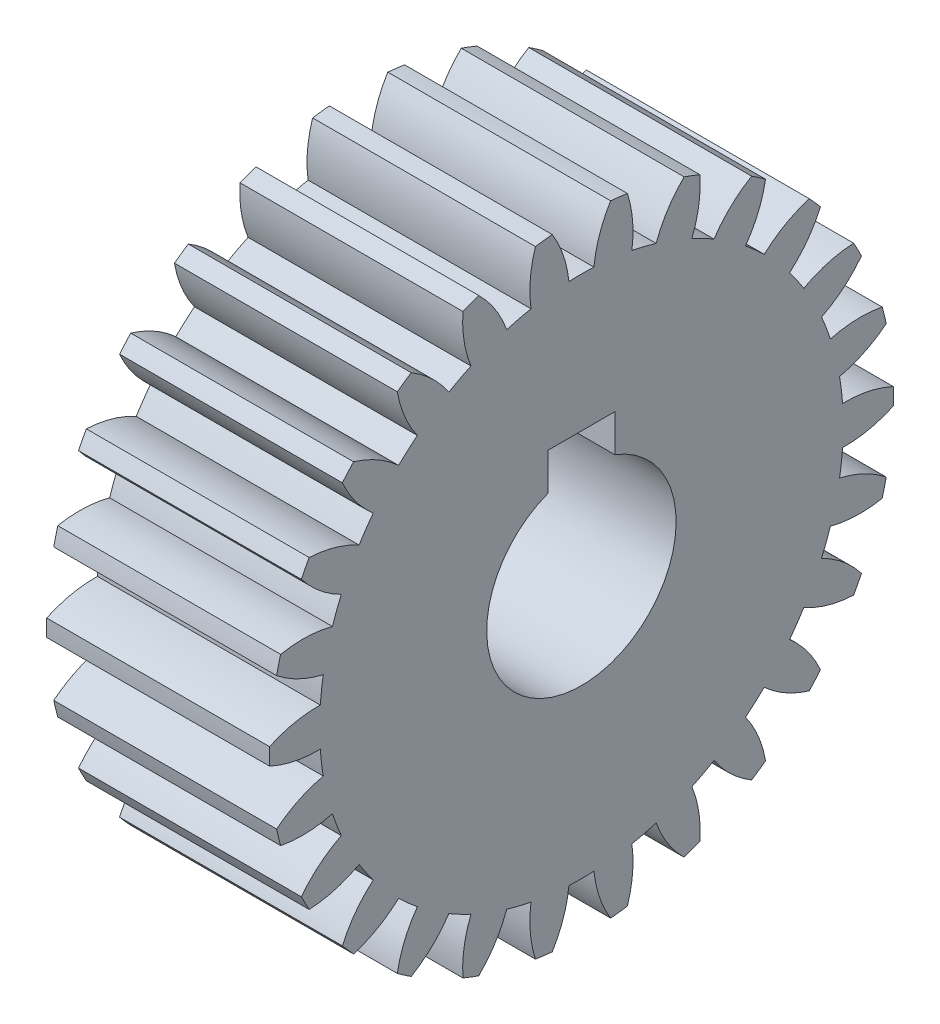
from build123d import *

# Parameters (mm, degrees)
BASPROSKE_W     = 20
BASPROSKE_H     = 28
TOOTHCUT_DEPTH  = 45.362146026
TEETHCUTS_COUNT = 26
TEETHCUTS_ANGLE = 346.153846154
BORSKE_R        = 8.5
BORE_DEPTH      = 50.0000508
KEYSKE_W        = 6
KEYSKE_H        = 11.3
KEYWAY_DEPTH    = 50.0000508


with BuildPart() as part:
    # BasProSke → Base-Revolve (revolve)
    with BuildSketch(Plane(origin=(0, 0, 0), x_dir=(1, 0, 0), z_dir=(0, 1, 0)), mode=Mode.PRIVATE) as base_revolve_sk:
        with Locations((10, 14)):
            Rectangle(BASPROSKE_W, BASPROSKE_H)
    revolve(base_revolve_sk.sketch.rotate(Axis((-10, 0, 0), (1, 0, 0)), 180), axis=Axis((-10, 0, 0), (1, 0, 0)))

    # TooCutSke → ToothCut (cut, through all)
    with BuildSketch(Plane(origin=(0, 0, 0), x_dir=(0, 0, -1), z_dir=(1, 0, 0))):
        with BuildLine():
            ThreePointArc((1.121687319, 23.472213755), (0, 23.499), (-1.121687319, 23.472213755))
            ThreePointArc((-1.121687319, 23.472213755), (-1.626477312, 25.772985276), (-2.63606961, 27.901150194))
            ThreePointArc((-2.63606961, 27.901150194), (0, 28.0254), (2.63606961, 27.901150194))
            ThreePointArc((2.63606961, 27.901150194), (1.626477312, 25.772985276), (1.121687319, 23.472213755))
        make_face()
    toothcut = extrude(amount=TOOTHCUT_DEPTH, mode=Mode.SUBTRACT)

    # TeethCuts: ToothCut ×26 about axis
    teethcuts_axis = Axis((-10, 0, 0), (1, 0, 0))
    for i in range(1, TEETHCUTS_COUNT):
        add(toothcut.rotate(teethcuts_axis, i * TEETHCUTS_ANGLE / (TEETHCUTS_COUNT - 1)), mode=Mode.SUBTRACT)

    # BorSke → Bore (cut, symmetric)
    with BuildSketch(Plane(origin=(0, 0, 0), x_dir=(0, 0, -1), z_dir=(1, 0, 0))):
        with Locations(Location((0, 0, 0), (0, 0, 180))):
            Circle(BORSKE_R)
    extrude(amount=BORE_DEPTH, both=True, mode=Mode.SUBTRACT)

    # KeySke → Keyway (cut, symmetric)
    with BuildSketch(Plane(origin=(0, 0, 0), x_dir=(0, 0, -1), z_dir=(1, 0, 0))):
        with Locations((0, 5.65)):
            Rectangle(KEYSKE_W, KEYSKE_H)
    extrude(amount=KEYWAY_DEPTH, both=True, mode=Mode.SUBTRACT)


solid = part.part
